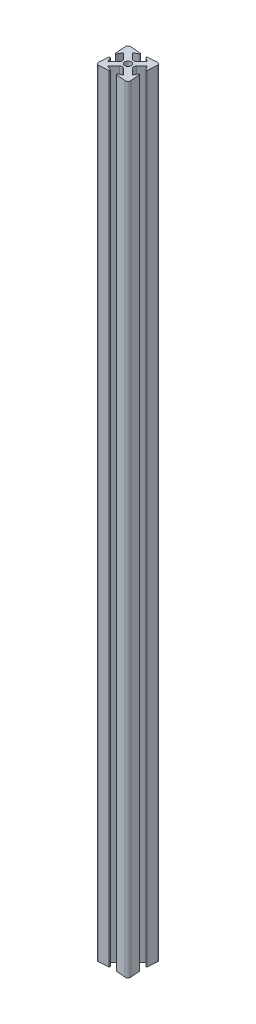
from build123d import *

# Parameters (mm, degrees)
BOSS_EXTRUDE1_DEPTH = 603.25
SKETCH8_R           = 2.565266714
CUT_EXTRUDE4_DEPTH  = 604.996
FILLET1_R           = 2.032
FILLET2_R           = 0.508
SKETCH5_W           = 12.655737404
SKETCH5_H           = 275.477439744
BOSS_EXTRUDE3_DEPTH = 4.572
SKETCH6_R           = 4.617709461
SKETCH6_R_2         = 4.503643825
SKETCH6_R_3         = 4.621904919
SKETCH6_R_4         = 4.672748293
SKETCH6_R_5         = 4.615964847
CUT_EXTRUDE2_DEPTH  = 4.572
SKETCH7_R           = 4.54487388
SKETCH7_R_2         = 4.672668652
CUT_EXTRUDE3_DEPTH  = 4.572
FILLET3_R           = 2.286


with BuildPart() as part:
    # Sketch2 → Boss-Extrude1 (new body)
    with BuildSketch(Plane(origin=(0, 0, 0), x_dir=(1, 0, 0), z_dir=(0, 1, 0))):
        Polygon((-16.258611825, -14.593573265), (-15.211300169, -2.97584616), (-12.901409331, -8.316313776), (2.370242199, 7.164742979), (-1.981461576, 9.939777323), (9.141388175, 10.806426735), (8.274738763, -0.316423015), (5.499704418, 4.03528076), (-9.981352337, -11.236370771), (-4.640884721, -13.546261608), align=None)
        Polygon((-15.391962413, -0.962649654), (-12.616928069, 3.750799497), (2.370242199, -11.236370771), (-2.346798037, -13.546261608), (9.141388175, -14.593573265), (8.094076519, -3.105387053), (5.784185681, -7.822427289), (-9.202984587, 7.164742979), (-4.489535436, 9.939777323), (-16.258611825, 10.806426735), align=None)
    extrude(amount=BOSS_EXTRUDE1_DEPTH)

    # Sketch8 → Cut-Extrude4 (cut)
    with BuildSketch(Plane(origin=(0, 603.25, 0), x_dir=(1, 0, 0), z_dir=(0, 1, 0))):
        with Locations(Location((-3.527048706, -1.915222876, 0), (0, 0, 270))):
            Circle(SKETCH8_R)
    extrude(amount=-CUT_EXTRUDE4_DEPTH, mode=Mode.SUBTRACT)

    # Fillet1
    fillet1_edges = [part.edges().sort_by_distance(p)[0] for p in [
        (9.141388175, 301.625, -10.806426735),
        (9.141388175, 301.625, 14.593573265),
        (-16.258611825, 301.625, 14.593573265),
        (-16.258611825, 301.625, -10.806426735),
    ]]
    fillet(fillet1_edges, radius=FILLET1_R)

    # Fillet2
    fillet2_edges = [part.edges().sort_by_distance(p)[0] for p in [
        (-1.981461576, 301.625, -9.939777323),
        (8.274738763, 301.625, 0.316423015),
        (8.094076519, 301.625, 3.105387053),
        (-2.346798037, 301.625, 13.546261608),
        (-4.640884721, 301.625, 13.546261608),
        (-15.211300169, 301.625, 2.97584616),
        (-15.391962413, 301.625, 0.962649654),
        (-4.489535436, 301.625, -9.939777323),
    ]]
    fillet(fillet2_edges, radius=FILLET2_R)

    # Sketch5 → Boss-Extrude3 (add)
    with BuildSketch(Plane(origin=(-0.781752329, 0, -10.033254025), x_dir=(-0.9969782897972478, 0, 0.07768069047681715), z_dir=(-0.07768069047681715, 0, -0.9969782897972478))):
        with Locations((2.46042797, 432.716085527)):
            Rectangle(SKETCH5_W, SKETCH5_H)
    extrude(amount=BOSS_EXTRUDE3_DEPTH)

    # Sketch6 → Cut-Extrude2 (cut)
    with BuildSketch(Plane(origin=(-1.136908446, 0, -14.591438766), x_dir=(-0.9969782897972478, 0, 0.07768069047681722), z_dir=(-0.07768069047681722, 0, -0.9969782897972478))):
        with Locations((2.46042797, 545.232588529)):
            Circle(SKETCH6_R)
        with Locations((2.46042797, 513.854170907)):
            Circle(SKETCH6_R_2)
        with Locations((2.46042797, 479.255100803)):
            Circle(SKETCH6_R_3)
        with Locations((2.46042797, 446.301604006)):
            Circle(SKETCH6_R_4)
        with Locations((2.46042797, 414.342225806)):
            Circle(SKETCH6_R_5)
    extrude(amount=-CUT_EXTRUDE2_DEPTH, mode=Mode.SUBTRACT)

    # Sketch7 → Cut-Extrude3 (cut)
    with BuildSketch(Plane(origin=(-1.136908446, 0, -14.591438766), x_dir=(-0.9969782897972478, 0, 0.07768069047681712), z_dir=(-0.07768069047681712, 0, -0.9969782897972478))):
        with Locations((2.610241648, 377.377881706)):
            Circle(SKETCH7_R)
        with Locations((2.157369038, 338.135767483)):
            Circle(SKETCH7_R_2)
    extrude(amount=-CUT_EXTRUDE3_DEPTH, mode=Mode.SUBTRACT)

    # Fillet3
    fillet3_edges = [part.edges().sort_by_distance(p)[0] for p in [
        (-0.326311914, 301.625, 1.711929695),
        (-6.767665082, 301.625, 2.09846349),
        (-3.376968255, 301.625, -1.338726647),
        (-3.76350205, 301.625, 5.102626521),
    ]]
    fillet(fillet3_edges, radius=FILLET3_R)


solid = part.part
